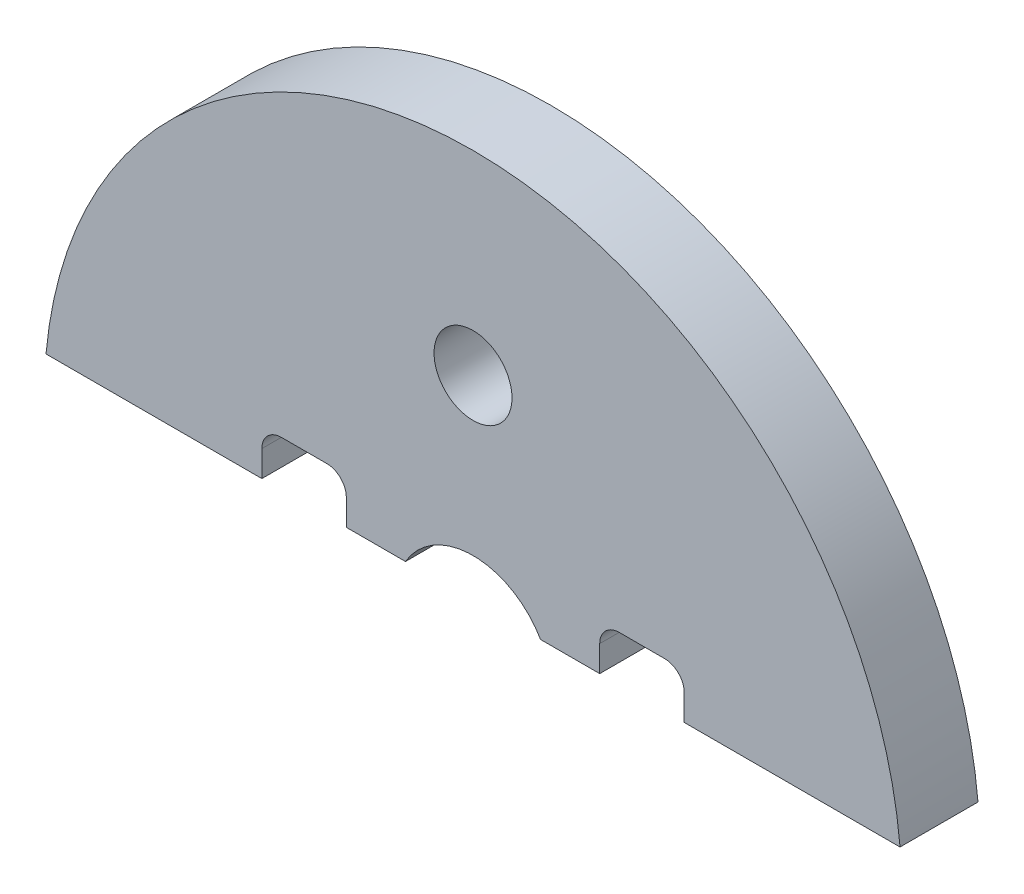
from build123d import *

# Parameters (mm, degrees)
MODEL_R                 = 1.5
SALIENTE_EXTRUIR1_DEPTH = 3


with BuildPart() as part:
    # Model → Saliente-Extruir1 (new body)
    with BuildSketch(Plane.XY):
        with BuildLine():
            Line((223.122807913, 245.202019993), (221.372807913, 245.202019993))
            ThreePointArc((221.372807913, 245.202019993), (220.842477828, 244.982350079), (220.622807913, 244.452019993))
            Line((220.622807913, 244.452019993), (220.622807913, 243.452019993))
            Line((220.622807913, 243.452019993), (218.345884125, 243.452019993))
            ThreePointArc((218.345884125, 243.452019993), (215.747807914, 244.952019993), (213.149731702, 243.452019993))
            Line((213.149731702, 243.452019993), (210.872807913, 243.452019993))
            Line((210.872807913, 243.452019993), (210.872807913, 244.452019993))
            ThreePointArc((210.872807913, 244.452019993), (210.653137999, 244.982350079), (210.122807913, 245.202019993))
            Line((210.122807913, 245.202019993), (208.372807913, 245.202019993))
            ThreePointArc((208.372807913, 245.202019993), (207.842477828, 244.982350079), (207.622807913, 244.452019993))
            Line((207.622807913, 244.452019993), (207.622807913, 243.452019993))
            Line((207.622807913, 243.452019993), (199.316131188, 243.452019993))
            ThreePointArc((199.316131188, 243.452019993), (215.747807914, 258.452019993), (232.179484639, 243.452019993))
            Line((232.179484639, 243.452019993), (223.872807913, 243.452019993))
            Line((223.872807913, 243.452019993), (223.872807913, 244.452019993))
            ThreePointArc((223.872807913, 244.452019993), (223.653137999, 244.982350079), (223.122807913, 245.202019993))
        make_face()
        with Locations((215.747807914, 250.952019993)):
            Circle(MODEL_R, mode=Mode.SUBTRACT)
    extrude(amount=SALIENTE_EXTRUIR1_DEPTH)


solid = part.part
